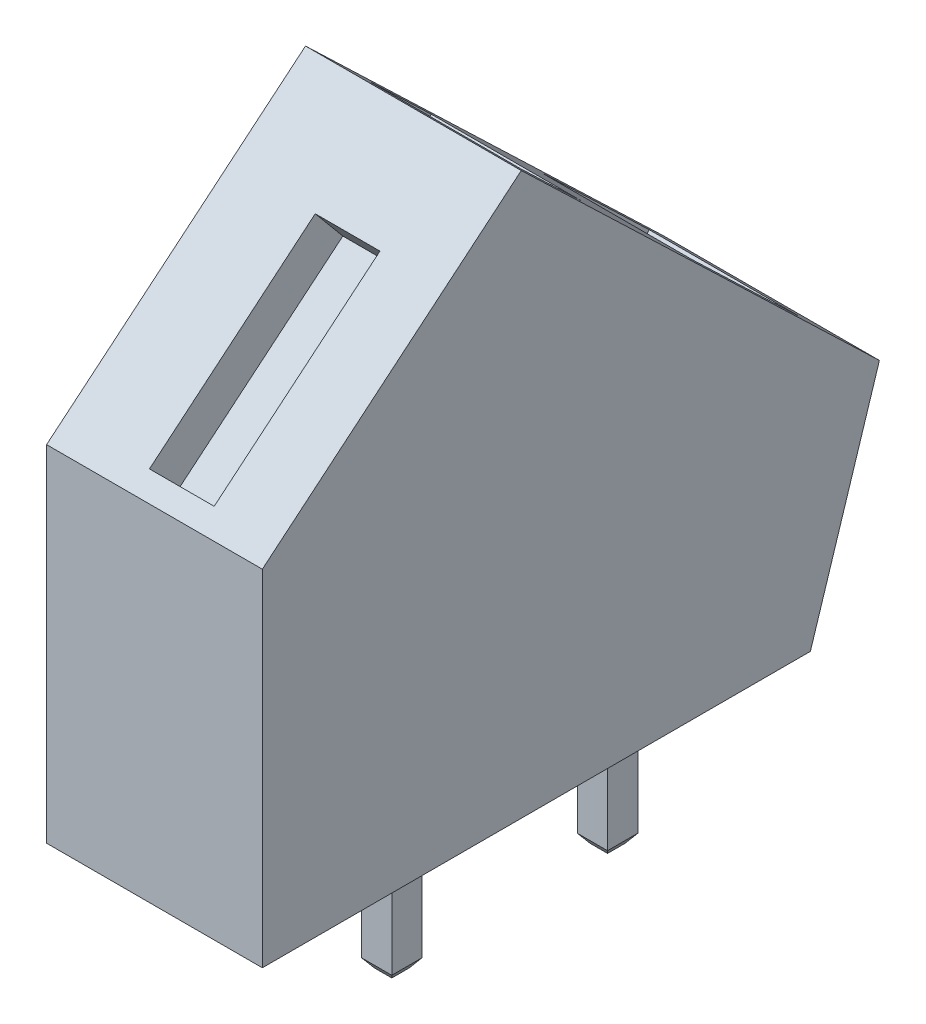
from build123d import *
from OCP.BRepFilletAPI import BRepFilletAPI_MakeChamfer

# Parameters (mm, degrees)
EXTRUDE_2_DEPTH     = 2.5
SKETCH_4_W          = 3.5
SKETCH_4_H          = 2
SKETCH_4_H_2        = 3.5
CUT_EXTRUDE_1_DEPTH = 1
SKETCH_5_W          = 1.5
SKETCH_5_H          = 5
CUT_EXTRUDE_2_DEPTH = 1
SKETCH_6_W          = 0.7
SKETCH_6_H          = 0.7
EXTRUDE_3_DEPTH     = 3.5
CHAMFER_3_SIZE      = 0.2
CHAMFER_3_SIZE2     = 0.145308506


with BuildPart() as part:
    # Эскиз2 → Бобышка-Вытянуть2 (new, symmetric)
    with BuildSketch(Plane(origin=(0, 0, 0), x_dir=(0, -1, 0), z_dir=(1, 0, 0))):
        Polygon((0, -6.35), (0, 6.35), (-5.040100503, 7.95), (-13, -0.35), (-8, -6.35), align=None)
    extrude(amount=EXTRUDE_2_DEPTH, both=True)

    # Эскиз4 → Вырез-Вытянуть1 (cut)
    with BuildSketch(Plane(origin=(0, 6.5969489, -6.326632557), x_dir=(1, 0, 0), z_dir=(0, 0.7217391304347853, -0.6921651736393851))):
        with Locations((0, -7.250755953)):
            Rectangle(SKETCH_4_W, SKETCH_4_H)
        with Locations((0, -1.000755953)):
            Rectangle(SKETCH_4_W, SKETCH_4_H_2)
    extrude(amount=-CUT_EXTRUDE_1_DEPTH, mode=Mode.SUBTRACT)

    # Эскиз5 → Вырез-Вытянуть2 (cut)
    with BuildSketch(Plane(origin=(0, 7.844262295, 6.536885246), x_dir=(1, 0, 0), z_dir=(0, 0.7682212795973735, 0.6401843996644827))):
        with Locations((0.25, 3.243270072)):
            Rectangle(SKETCH_5_W, SKETCH_5_H)
    extrude(amount=-CUT_EXTRUDE_2_DEPTH, mode=Mode.SUBTRACT)

    # Эскиз6 → Бобышка-Вытянуть3 (add)
    with BuildSketch(Plane.XZ):
        with Locations((0.5, 1.35)):
            Rectangle(SKETCH_6_W, SKETCH_6_H)
        with Locations((0.5, -3.65)):
            Rectangle(SKETCH_6_W, SKETCH_6_H)
    extrude(amount=EXTRUDE_3_DEPTH)

    # Фаска3: one chamfer whose edges measure the first distance from different faces: ONE call of the kernel's chamfer builder (chamfer() names one face for all edges)
    chamfer_3_edges_1 = [part.edges().sort_by_distance(p)[0] for p in [
        (0.15, -3.5, 1.35),
    ]]
    chamfer_3_side_1 = [part.faces().sort_by_distance(p)[0] for p in [
        (0.15, -1.75, 1.35),
    ]]
    chamfer_3_edges_2 = [part.edges().sort_by_distance(p)[0] for p in [
        (0.5, -3.5, 1),
    ]]
    chamfer_3_side_2 = [part.faces().sort_by_distance(p)[0] for p in [
        (0.5, -1.75, 1),
    ]]
    chamfer_3_edges_3 = [part.edges().sort_by_distance(p)[0] for p in [
        (0.85, -3.5, 1.35),
    ]]
    chamfer_3_side_3 = [part.faces().sort_by_distance(p)[0] for p in [
        (0.85, -1.75, 1.35),
    ]]
    chamfer_3_edges_4 = [part.edges().sort_by_distance(p)[0] for p in [
        (0.5, -3.5, 1.7),
    ]]
    chamfer_3_side_4 = [part.faces().sort_by_distance(p)[0] for p in [
        (0.5, -1.75, 1.7),
    ]]
    chamfer_3_edges_5 = [part.edges().sort_by_distance(p)[0] for p in [
        (0.15, -3.5, -3.65),
    ]]
    chamfer_3_side_5 = [part.faces().sort_by_distance(p)[0] for p in [
        (0.15, -1.75, -3.65),
    ]]
    chamfer_3_edges_6 = [part.edges().sort_by_distance(p)[0] for p in [
        (0.5, -3.5, -4),
    ]]
    chamfer_3_side_6 = [part.faces().sort_by_distance(p)[0] for p in [
        (0.5, -1.75, -4),
    ]]
    chamfer_3_edges_7 = [part.edges().sort_by_distance(p)[0] for p in [
        (0.85, -3.5, -3.65),
    ]]
    chamfer_3_side_7 = [part.faces().sort_by_distance(p)[0] for p in [
        (0.85, -1.75, -3.65),
    ]]
    chamfer_3_edges_8 = [part.edges().sort_by_distance(p)[0] for p in [
        (0.5, -3.5, -3.3),
    ]]
    chamfer_3_side_8 = [part.faces().sort_by_distance(p)[0] for p in [
        (0.5, -1.75, -3.3),
    ]]
    chamfer_3 = BRepFilletAPI_MakeChamfer(part.part.solid().wrapped)
    for e in chamfer_3_edges_1:
        chamfer_3.Add(CHAMFER_3_SIZE, CHAMFER_3_SIZE2, e.wrapped, chamfer_3_side_1[0].wrapped)  # the first distance lies on this face
    for e in chamfer_3_edges_2:
        chamfer_3.Add(CHAMFER_3_SIZE, CHAMFER_3_SIZE2, e.wrapped, chamfer_3_side_2[0].wrapped)  # the first distance lies on this face
    for e in chamfer_3_edges_3:
        chamfer_3.Add(CHAMFER_3_SIZE, CHAMFER_3_SIZE2, e.wrapped, chamfer_3_side_3[0].wrapped)  # the first distance lies on this face
    for e in chamfer_3_edges_4:
        chamfer_3.Add(CHAMFER_3_SIZE, CHAMFER_3_SIZE2, e.wrapped, chamfer_3_side_4[0].wrapped)  # the first distance lies on this face
    for e in chamfer_3_edges_5:
        chamfer_3.Add(CHAMFER_3_SIZE, CHAMFER_3_SIZE2, e.wrapped, chamfer_3_side_5[0].wrapped)  # the first distance lies on this face
    for e in chamfer_3_edges_6:
        chamfer_3.Add(CHAMFER_3_SIZE, CHAMFER_3_SIZE2, e.wrapped, chamfer_3_side_6[0].wrapped)  # the first distance lies on this face
    for e in chamfer_3_edges_7:
        chamfer_3.Add(CHAMFER_3_SIZE, CHAMFER_3_SIZE2, e.wrapped, chamfer_3_side_7[0].wrapped)  # the first distance lies on this face
    for e in chamfer_3_edges_8:
        chamfer_3.Add(CHAMFER_3_SIZE, CHAMFER_3_SIZE2, e.wrapped, chamfer_3_side_8[0].wrapped)  # the first distance lies on this face
    add(Compound.cast(chamfer_3.Shape()), mode=Mode.REPLACE)


solid = part.part
